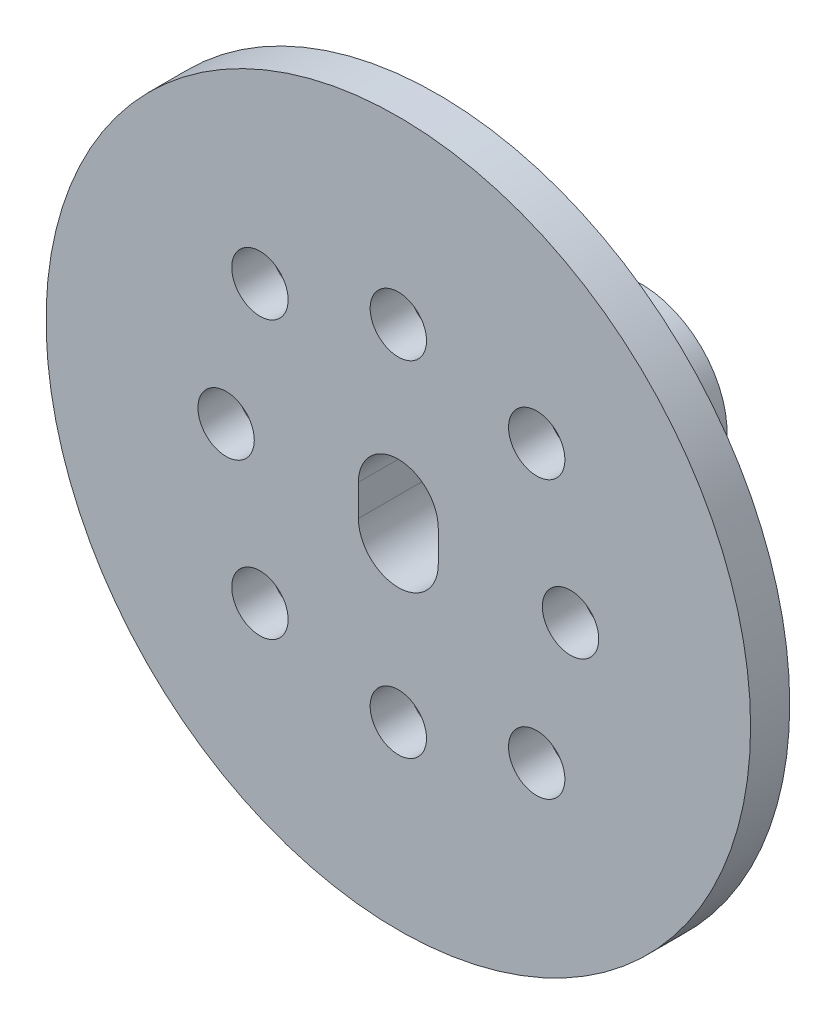
from build123d import *

# Parameters (mm, degrees)
SKETCH_1_R          = 22.5
EXTRUDE_1_DEPTH     = 2.5
SKETCH_4_R          = 7.5
EXTRUDE_2_DEPTH     = 4
SKETCH_5_R          = 7.5
SKETCH_5_R_2        = 3.55
EXTRUDE_3_DEPTH     = 9
SKETCH_6_R          = 1.8
CUT_EXTRUDE_2_DEPTH = 6
FILLET_1_R          = 0.5
CUT_EXTRUDE_3_DEPTH = 34.068111528
SKETCH_8_R          = 7.500275011
SKETCH_8_R_2        = 5.5
CUT_EXTRUDE_4_DEPTH = 13


with BuildPart() as part:
    # 草图1 → 凸台-拉伸1 (new body)
    with BuildSketch(Plane.XY):
        Circle(SKETCH_1_R)
    extrude(amount=EXTRUDE_1_DEPTH)

    # 草图4 → 凸台-拉伸2 (add)
    with BuildSketch(Plane(origin=(0, 0, 0), x_dir=(-1, 0, 0), z_dir=(0, 0, -1))):
        Circle(SKETCH_4_R)
    extrude(amount=EXTRUDE_2_DEPTH)

    # 草图5 → 凸台-拉伸3 (add)
    # profile 1 of 3: a face of its own
    with BuildSketch(Plane(origin=(0, 0, -4), x_dir=(-1, 0, 0), z_dir=(0, 0, -1))):
        with Locations(Location((0, 0, 0), (0, 0, 239.61601222))):
            Circle(SKETCH_5_R)
        with Locations((-0.000237242, 0.000139094)):
            Circle(SKETCH_5_R_2, mode=Mode.SUBTRACT)
    # profile 2 of 3: a face of its own
    with BuildSketch(Plane(origin=(0, 0, -4), x_dir=(-1, 0, 0), z_dir=(0, 0, -1))):
        with BuildLine():
            ThreePointArc((-0.000237242, -3.549860906), (-1.803359534, -2.802983198), (-2.550237242, -0.999860906))
            Line((-2.550237242, -0.999860906), (-2.550237242, 1.000139094))
            ThreePointArc((-2.550237242, 1.000139094), (-1.803359534, 2.803261386), (-0.000237242, 3.550139094))
            ThreePointArc((-0.000237242, 3.550139094), (-3.550237242, 0.000139094), (-0.000237242, -3.549860906))
        make_face()
    # profile 3 of 3: a face of its own
    with BuildSketch(Plane(origin=(0, 0, -4), x_dir=(-1, 0, 0), z_dir=(0, 0, -1))):
        with BuildLine():
            ThreePointArc((2.549762758, -0.999860906), (1.80288505, -2.802983198), (-0.000237242, -3.549860906))
            ThreePointArc((-0.000237242, -3.549860906), (2.509991831, -2.510089979), (3.549762758, 0.000139094))
            ThreePointArc((3.549762758, 0.000139094), (2.509991831, 2.510368167), (-0.000237242, 3.550139094))
            ThreePointArc((-0.000237242, 3.550139094), (1.80288505, 2.803261386), (2.549762758, 1.000139094))
            Line((2.549762758, 1.000139094), (2.549762758, -0.999860906))
        make_face()
    extrude(amount=EXTRUDE_3_DEPTH)

    # 草图6 → 切除-拉伸2 (cut)
    with BuildSketch(Plane.XY.offset(2.5)):
        with Locations((0, 11)):
            Circle(SKETCH_6_R)
        with Locations((-8.838834765, 8.838834765)):
            Circle(SKETCH_6_R)
        with Locations((8.838834765, 8.838834765)):
            Circle(SKETCH_6_R)
        with Locations((8.838834765, -8.838834765)):
            Circle(SKETCH_6_R)
        with Locations((-8.838834765, -8.838834765)):
            Circle(SKETCH_6_R)
        with Locations((11, 0)):
            Circle(SKETCH_6_R)
        with Locations((0, -11)):
            Circle(SKETCH_6_R)
        with Locations((-11, 0)):
            Circle(SKETCH_6_R)
    extrude(amount=-CUT_EXTRUDE_2_DEPTH, mode=Mode.SUBTRACT)

    # 圆角1
    fillet_1_edges = [part.edges().sort_by_distance(p)[0] for p in [
        (0.000237242, -3.549860906, -13),
        (0.000237242, 3.550139094, -13),
        (-2.549762758, 0.000139094, -13),
        (2.550237242, 0.000139094, -13),
    ]]
    fillet(fillet_1_edges, radius=FILLET_1_R)

    # 草图7 → 切除-拉伸3 (cut, through all)
    with BuildSketch(Plane(origin=(0, 0, -4), x_dir=(-1, 0, 0), z_dir=(0, 0, -1))):
        with BuildLine():
            Line((-2.550237242, 1.000139094), (-2.550237242, -0.999860906))
            ThreePointArc((-2.550237242, -0.999860906), (-0.000237242, -3.549860906), (2.549762758, -0.999860906))
            Line((2.549762758, -0.999860906), (2.549762758, 1.000139094))
            ThreePointArc((2.549762758, 1.000139094), (-0.000237242, 3.550139094), (-2.550237242, 1.000139094))
        make_face()
    extrude(amount=-CUT_EXTRUDE_3_DEPTH, mode=Mode.SUBTRACT)

    # 草图8 → 切除-拉伸4 (cut)
    with BuildSketch(Plane(origin=(0, 0, -13), x_dir=(-1, 0, 0), z_dir=(0, 0, -1))):
        Circle(SKETCH_8_R)
        Circle(SKETCH_8_R_2, mode=Mode.SUBTRACT)
    extrude(amount=-CUT_EXTRUDE_4_DEPTH, mode=Mode.SUBTRACT)


solid = part.part
